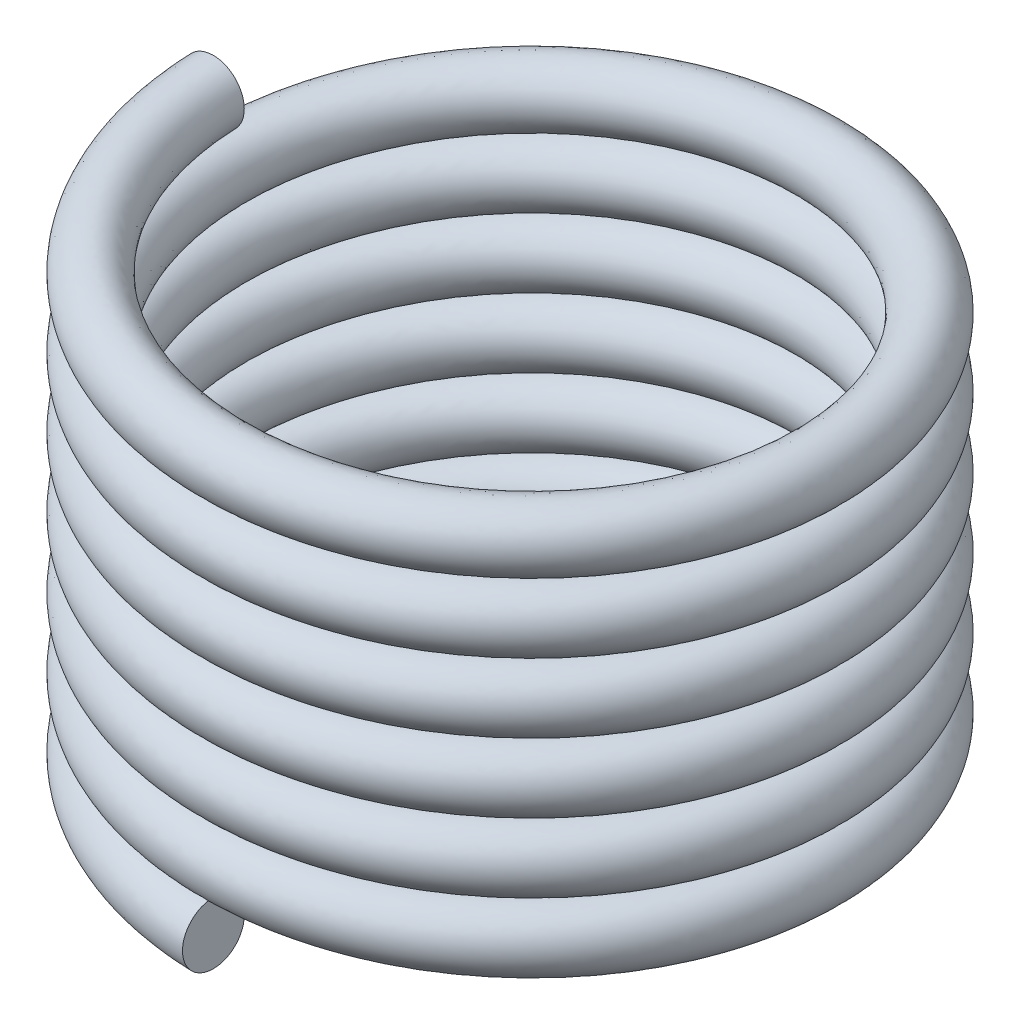
from build123d import *

# Parameters (mm, degrees)
WYCI_GNI_CIE_PO_CIE_CE1_PITCH  = 2.8
WYCI_GNI_CIE_PO_CIE_CE1_HEIGHT = 17.5
WYCI_GNI_CIE_PO_CIE_CE1_RADIUS = 12
SZKIC1_R                       = 1.25


with BuildPart() as part:
    # Wyciągnięcie po ścieżce1: sweep along a helix
    with BuildLine() as wyci_gni_cie_po_cie_ce1_path:
        Helix(WYCI_GNI_CIE_PO_CIE_CE1_PITCH, WYCI_GNI_CIE_PO_CIE_CE1_HEIGHT, WYCI_GNI_CIE_PO_CIE_CE1_RADIUS, center=(0, 0, 0), direction=(0, 1, 0), lefthand=True)
    # Szkic1 → Wyciągnięcie po ścieżce1 (sweep)
    with BuildSketch(Plane(origin=(0, 0, 0), x_dir=(0, 0, -1), z_dir=(1, 0, 0))):
        with Locations((-12, 0)):
            Circle(SZKIC1_R)
    sweep(path=wyci_gni_cie_po_cie_ce1_path.line, is_frenet=True)


solid = part.part
